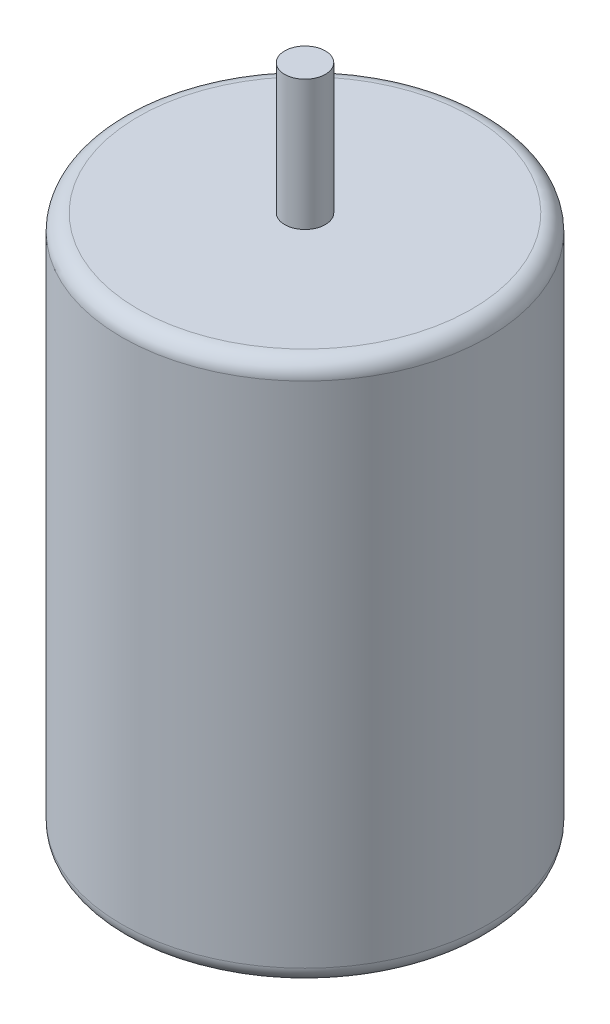
from build123d import *

# Parameters (mm, degrees)
SKETCH_1_R      = 22.5
EXTRUDE_1_DEPTH = 66.5
SKETCH_2_R      = 2.5
EXTRUDE_2_DEPTH = 16
FILLET_1_R      = 2


with BuildPart() as part:
    # 草圖1 → 填料-伸長1 (new body)
    with BuildSketch(Plane(origin=(0, 0, 0), x_dir=(1, 0, 0), z_dir=(0, 1, 0))):
        with Locations(Location((0, 0, 0), (0, 0, 270))):
            Circle(SKETCH_1_R)
    extrude(amount=EXTRUDE_1_DEPTH)

    # 草圖2 → 填料-伸長2 (add)
    with BuildSketch(Plane(origin=(0, 66.5, 0), x_dir=(1, 0, 0), z_dir=(0, 1, 0))):
        with Locations(Location((0, 0, 0), (0, 0, 270))):
            Circle(SKETCH_2_R)
    extrude(amount=EXTRUDE_2_DEPTH)

    # 圓角1
    fillet_1_edges = [part.edges().sort_by_distance(p)[0] for p in [
        (0, 0, -22.5),
        (0, 66.5, -22.5),
    ]]
    fillet(fillet_1_edges, radius=FILLET_1_R)


solid = part.part
